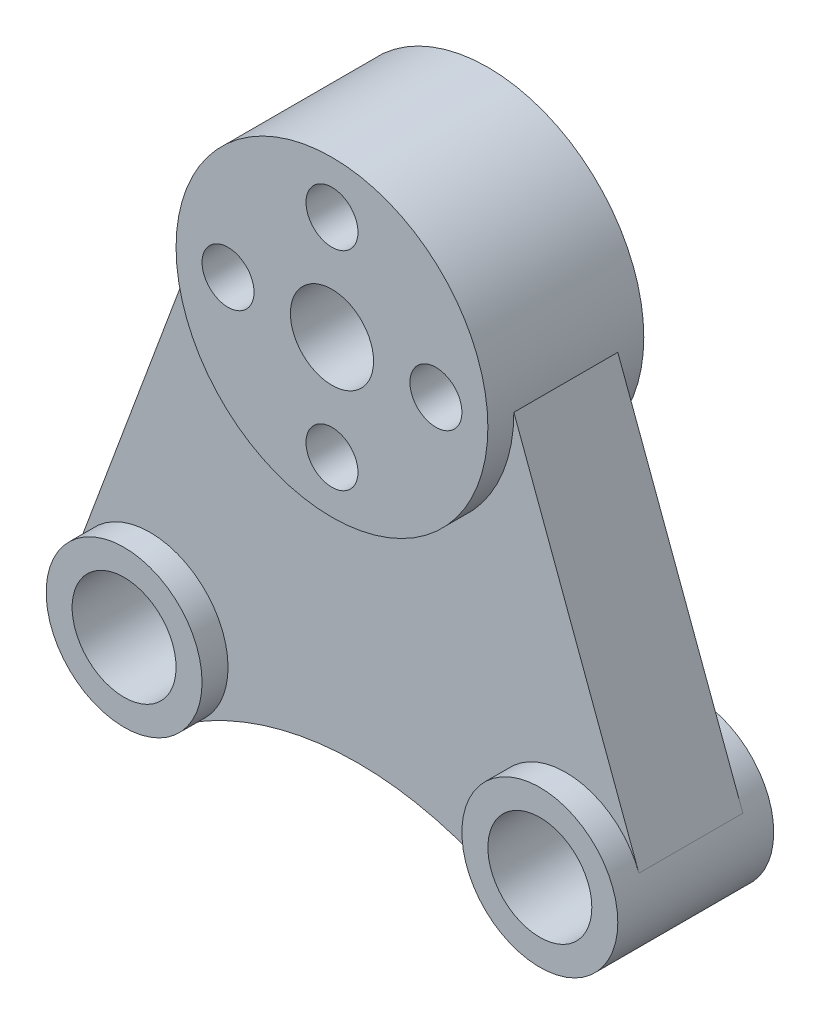
from build123d import *

# Parameters (mm, degrees)
SKETCH1_R             = 30
SKETCH1_R_2           = 5
SKETCH1_R_3           = 8
BOSS_EXTRUDE1_DEPTH   = 15
SKETCH1_R_4           = 15
SKETCH1_R_5           = 10
BOSS_EXTRUDE1_2_DEPTH = 15
BOSS_EXTRUDE1_3_DEPTH = 15
BOSS_EXTRUDE2_DEPTH   = 10


with BuildPart() as part:
    # Sketch1 → Boss-Extrude1 (new, symmetric)
    with BuildSketch(Plane.XY):
        Circle(SKETCH1_R)
        with Locations((0, -20)):
            Circle(SKETCH1_R_2, mode=Mode.SUBTRACT)
        with Locations((-20, 0)):
            Circle(SKETCH1_R_2, mode=Mode.SUBTRACT)
        Circle(SKETCH1_R_3, mode=Mode.SUBTRACT)
        with Locations((0, 20)):
            Circle(SKETCH1_R_2, mode=Mode.SUBTRACT)
        with Locations((20, 0)):
            Circle(SKETCH1_R_2, mode=Mode.SUBTRACT)
    extrude(amount=BOSS_EXTRUDE1_DEPTH, both=True)



with BuildPart() as body_2:
    # Sketch1 → Boss-Extrude1 2 (new, symmetric)
    with BuildSketch(Plane.XY):
        with Locations((-40, -70)):
            Circle(SKETCH1_R_4)
        with Locations((-40, -70)):
            Circle(SKETCH1_R_5, mode=Mode.SUBTRACT)
    extrude(amount=BOSS_EXTRUDE1_2_DEPTH, both=True)


with BuildPart() as body_3:
    # Sketch1 → Boss-Extrude1 3 (new, symmetric)
    with BuildSketch(Plane.XY):
        with Locations((40, -70)):
            Circle(SKETCH1_R_4)
        with Locations((40, -70)):
            Circle(SKETCH1_R_5, mode=Mode.SUBTRACT)
    extrude(amount=BOSS_EXTRUDE1_3_DEPTH, both=True)


with BuildPart() as part_1:
    add(part.part)

    add(body_2.part)  # Boss-Extrude2 merges body 2

    add(body_3.part)  # Boss-Extrude2 merges body 3
    # Sketch1<3> → Boss-Extrude2 (add, symmetric)
    with BuildSketch(Plane.XY):
        with BuildLine():
            ThreePointArc((30, 0), (0, -30), (-30, 0))
            Line((-30, 0), (-54.061288709, -64.776958756))
            ThreePointArc((-54.061288709, -64.776958756), (-37.3466371, -55.236542908), (-25, -70))
            ThreePointArc((-25, -70), (-26.866074463, -77.245688373), (-32, -82.68857754))
            ThreePointArc((-32, -82.68857754), (0, -73.442887702), (32, -82.68857754))
            ThreePointArc((32, -82.68857754), (30.545301323, -58.354886307), (54.061288709, -64.776958756))
            Line((54.061288709, -64.776958756), (30, 0))
        make_face()
    extrude(amount=BOSS_EXTRUDE2_DEPTH, both=True)


solid = part_1.part
